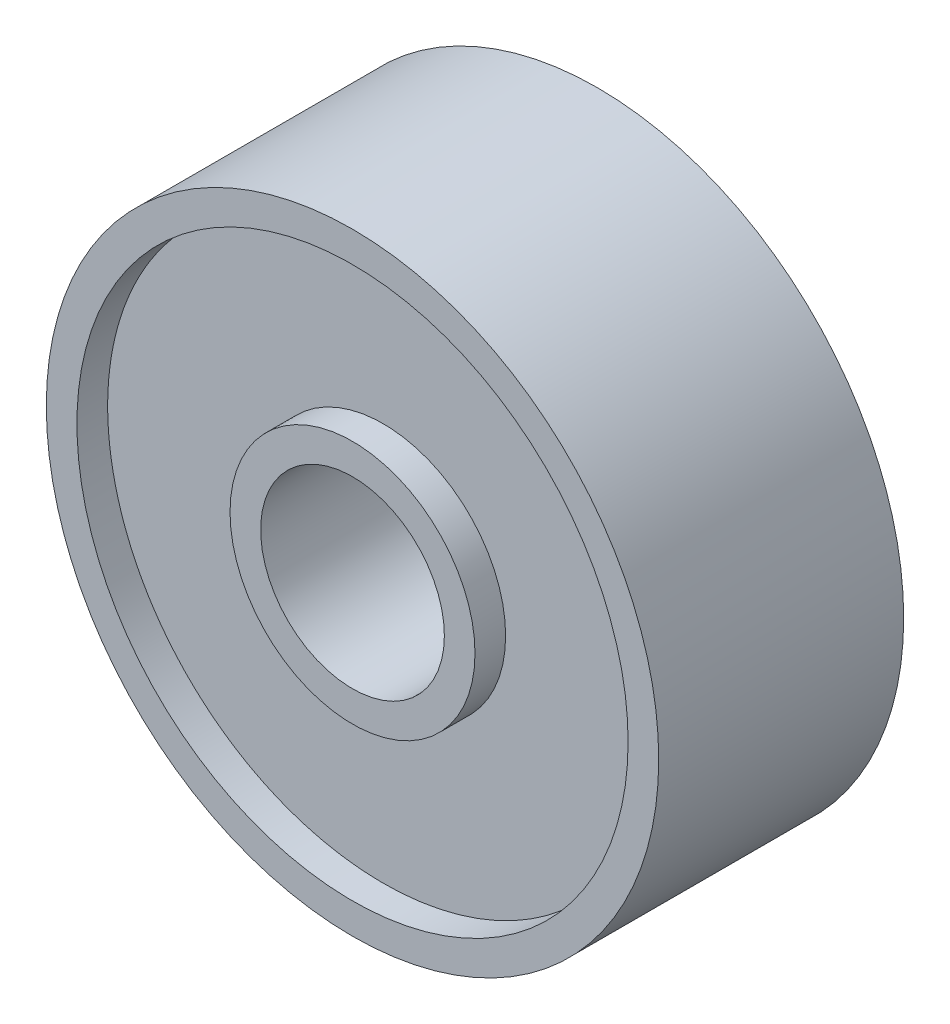
from build123d import *

# Parameters (mm, degrees)
SKETCH1_R             = 5
SKETCH1_R_2           = 4.5
BOSS_EXTRUDE1_DEPTH   = 4
SKETCH1_R_3           = 2
SKETCH1_R_4           = 1.5
BOSS_EXTRUDE1_2_DEPTH = 4
BOSS_EXTRUDE2_START   = -1.2e-05
SKETCH1_3_R           = 4.5
SKETCH1_3_R_2         = 2
BOSS_EXTRUDE2_DEPTH   = 4.000012
SKETCH2_R             = 4.5
SKETCH2_R_2           = 2
CUT_EXTRUDE3_DEPTH    = 0.5
CUT_EXTRUDE4_START    = -0.5
SKETCH3_R             = 4.5
SKETCH3_R_2           = 2
CUT_EXTRUDE4_DEPTH    = 0.5


with BuildPart() as part:
    # Sketch1 → Boss-Extrude1 (new body)
    with BuildSketch(Plane.XY):
        Circle(SKETCH1_R)
        Circle(SKETCH1_R_2, mode=Mode.SUBTRACT)
    extrude(amount=BOSS_EXTRUDE1_DEPTH)


with BuildPart() as body_2:
    # Sketch1 → Boss-Extrude1 2 (new body)
    with BuildSketch(Plane.XY):
        Circle(SKETCH1_R_3)
        Circle(SKETCH1_R_4, mode=Mode.SUBTRACT)
    extrude(amount=BOSS_EXTRUDE1_2_DEPTH)


with BuildPart() as body_3:
    # Sketch1<3> → Boss-Extrude2 (new body)
    with BuildSketch(Plane.XY.offset(BOSS_EXTRUDE2_START)):
        Circle(SKETCH1_3_R)
        Circle(SKETCH1_3_R_2, mode=Mode.SUBTRACT)
    extrude(amount=BOSS_EXTRUDE2_DEPTH)

    # Sketch2 → Cut-Extrude3 (cut)
    with BuildSketch(Plane(origin=(0, 0, -1.2e-05), x_dir=(-1, 0, 0), z_dir=(0, 0, -1))):
        Circle(SKETCH2_R)
        Circle(SKETCH2_R_2, mode=Mode.SUBTRACT)
    extrude(amount=-CUT_EXTRUDE3_DEPTH, mode=Mode.SUBTRACT)

    # Sketch3 → Cut-Extrude4 (cut)
    with BuildSketch(Plane.XY.offset(4).offset(CUT_EXTRUDE4_START)):
        with Locations(Location((0, 0, 0), (0, 0, 180))):
            Circle(SKETCH3_R)
        with Locations(Location((0, 0, 0), (0, 0, 180))):
            Circle(SKETCH3_R_2, mode=Mode.SUBTRACT)
    extrude(amount=CUT_EXTRUDE4_DEPTH, mode=Mode.SUBTRACT)


solid = Compound([part.part, body_2.part, body_3.part])
